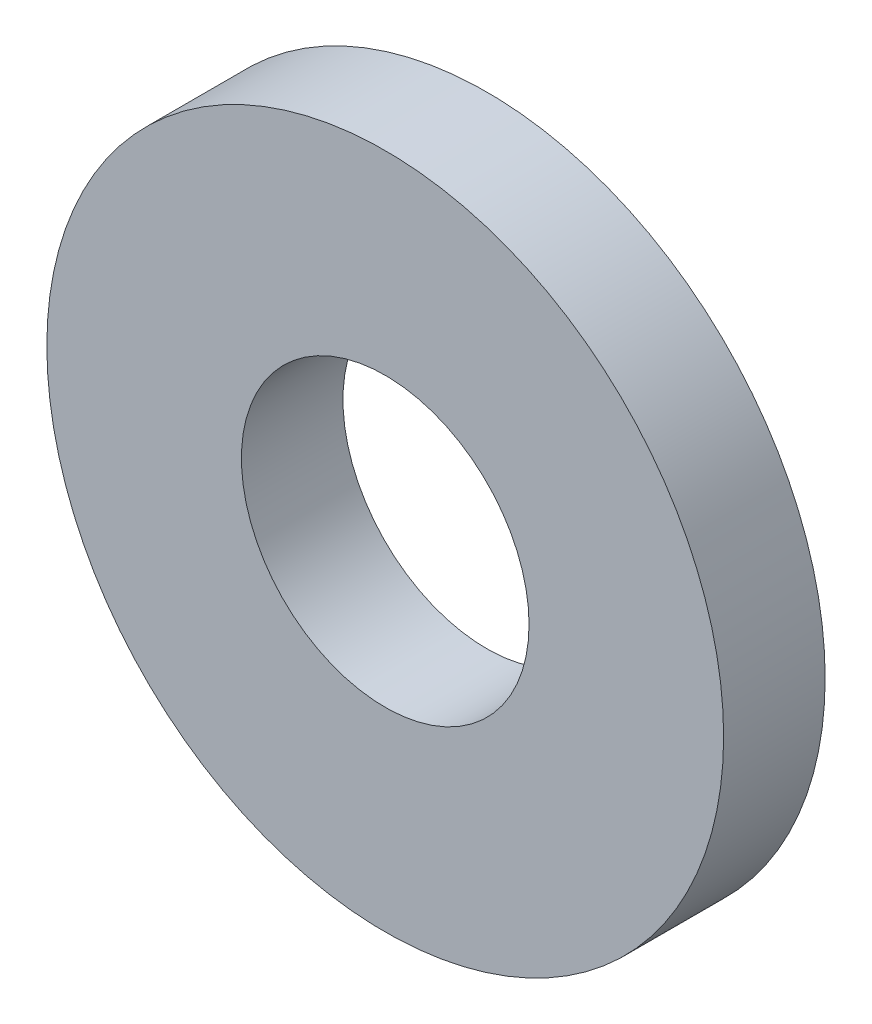
from build123d import *

# Parameters (mm, degrees)
CROQUIS1_R              = 10
CROQUIS1_R_2            = 4.25
SALIENTE_EXTRUIR1_DEPTH = 3


with BuildPart() as part:
    # Croquis1 → Saliente-Extruir1 (new body)
    with BuildSketch(Plane.XY):
        Circle(CROQUIS1_R)
        Circle(CROQUIS1_R_2, mode=Mode.SUBTRACT)
    extrude(amount=SALIENTE_EXTRUIR1_DEPTH)


solid = part.part
